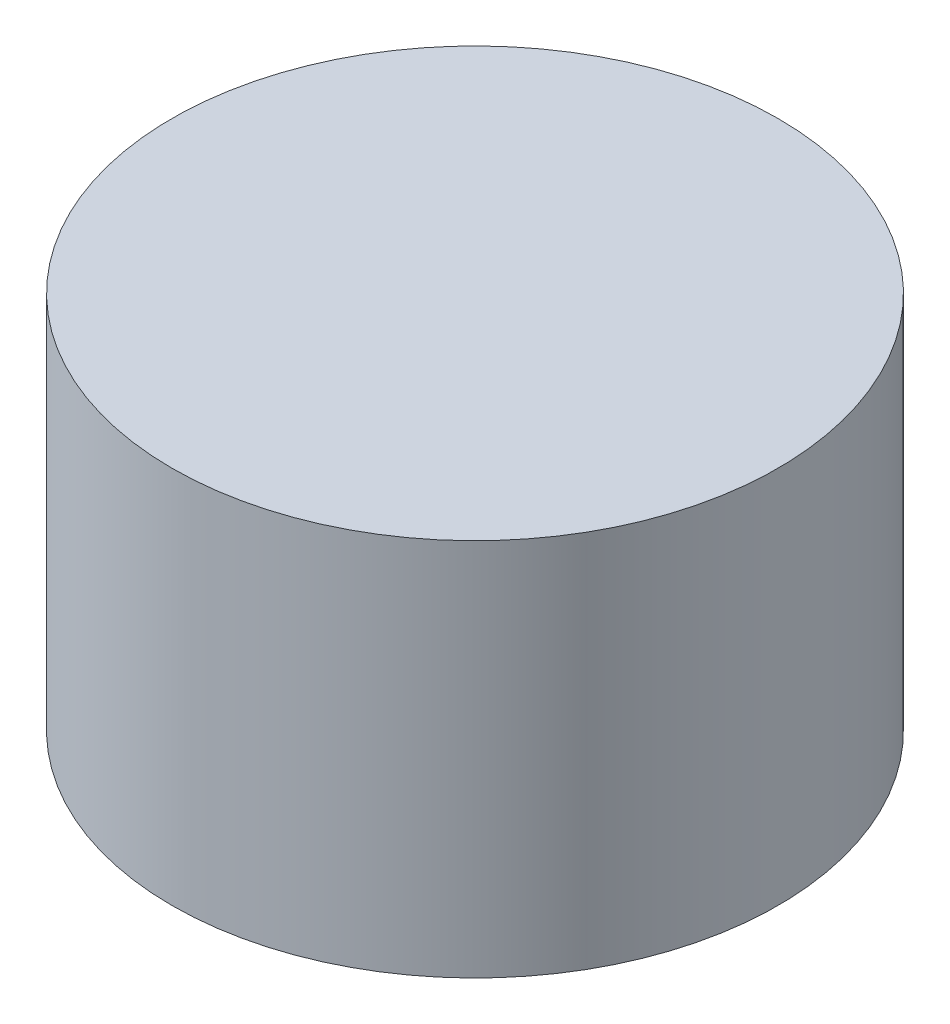
from build123d import *

# Parameters (mm, degrees)
SKETCH1_R           = 4
BOSS_EXTRUDE1_DEPTH = 5


with BuildPart() as part:
    # Sketch1 → Boss-Extrude1 (new body)
    with BuildSketch(Plane(origin=(0, 0, 0), x_dir=(1, 0, 0), z_dir=(0, 1, 0))):
        with Locations(Location((0, 0, 0), (0, 0, 270))):
            Circle(SKETCH1_R)
    extrude(amount=BOSS_EXTRUDE1_DEPTH)


solid = part.part
